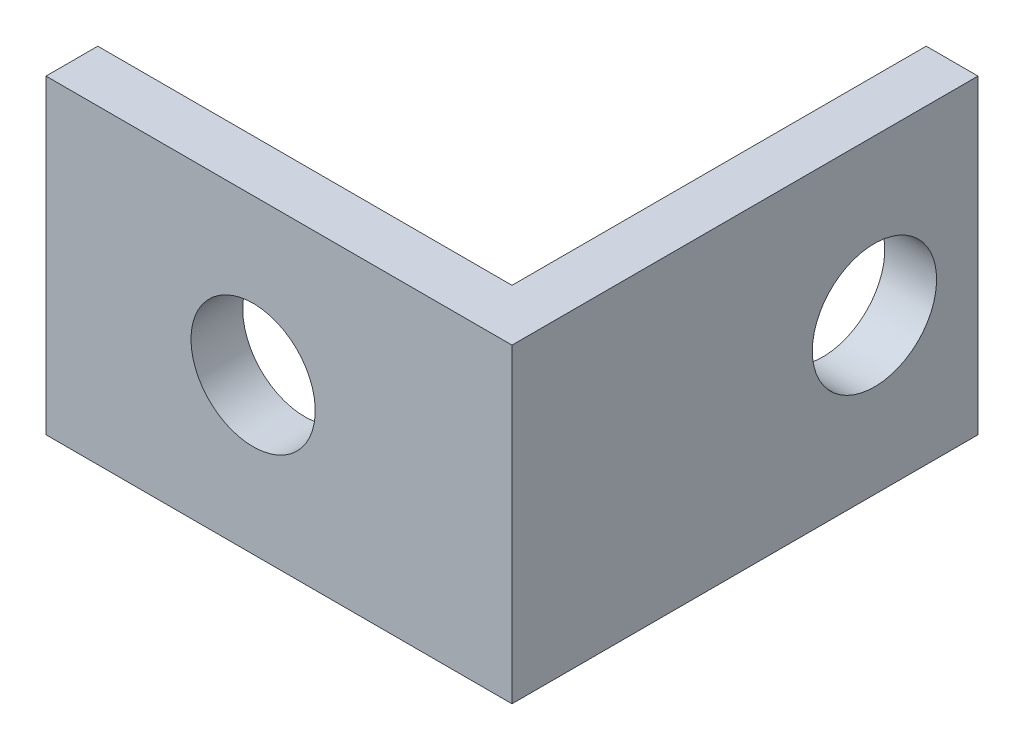
from build123d import *

# Parameters (mm, degrees)
BOSS_EXTRUDE2_DEPTH = 15
SKETCH4_R           = 3
CUT_EXTRUDE2_DEPTH  = 34.634060118
SKETCH7_R           = 3
CUT_EXTRUDE4_DEPTH  = 34.634060118


with BuildPart() as part:
    # Sketch3 → Boss-Extrude2 (new body)
    with BuildSketch(Plane(origin=(0, 0, 0), x_dir=(1, 0, 0), z_dir=(0, 1, 0))):
        Polygon((0, 0), (22.5, 0), (22.5, 22.5), (20, 22.5), (20, 2.5), (0, 2.5), align=None)
    extrude(amount=BOSS_EXTRUDE2_DEPTH)

    # Sketch4 → Cut-Extrude2 (cut, through all)
    with BuildSketch(Plane(origin=(0, 0, -2.5), x_dir=(-1, 0, 0), z_dir=(0, 0, -1))):
        with Locations((-10, 7.5)):
            Circle(SKETCH4_R)
    extrude(amount=-CUT_EXTRUDE2_DEPTH, mode=Mode.SUBTRACT)

    # Sketch7 → Cut-Extrude4 (cut, through all)
    with BuildSketch(Plane.ZY.offset(-20)):
        with Locations((-17.5, 7.5)):
            Circle(SKETCH7_R)
    extrude(amount=-CUT_EXTRUDE4_DEPTH, mode=Mode.SUBTRACT)


solid = part.part
